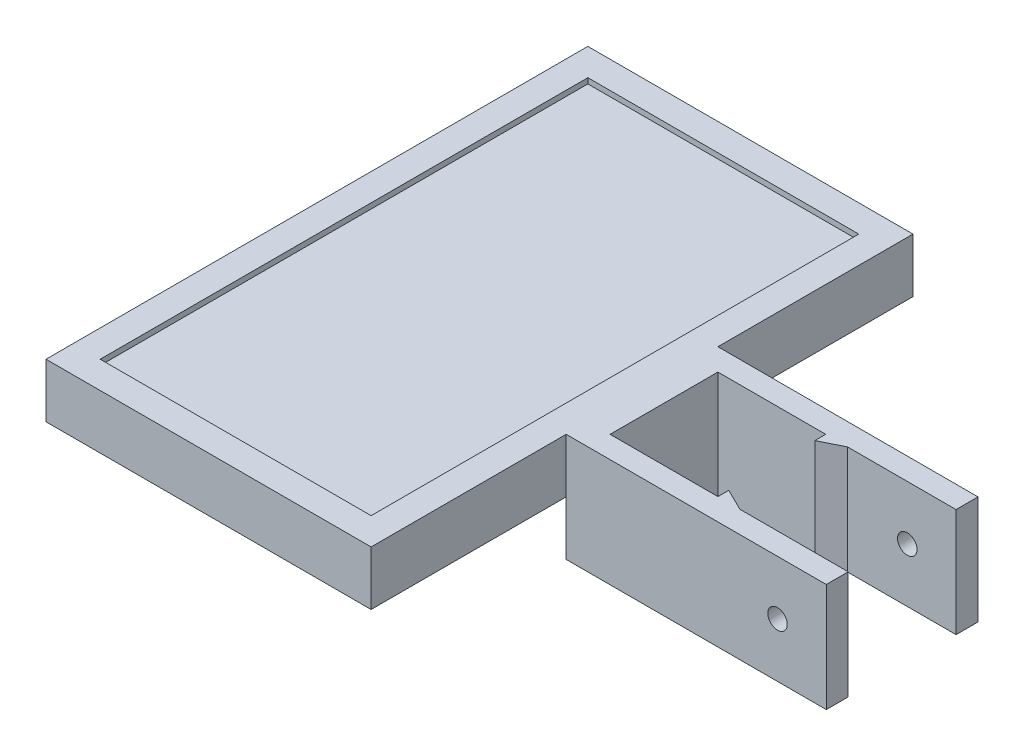
from build123d import *

# Parameters (mm, degrees)
SKETCH_1_W                      = 28
SKETCH_1_H                      = 28
SKETCH_1_W_2                    = 19.9
SKETCH_1_H_2                    = 19.9
EXTRUDE_1_DEPTH                 = 20
CUT_EXTRUDE_1_DEPTH             = 20
SKETCH_3_W                      = 20
SKETCH_3_H                      = 4.05
EXTRUDE_2_DEPTH                 = 20
CUT_EXTRUDE_2_REACH             = 48.148
SKETCH_4_R                      = 1.8
CUT_EXTRUDE_2_DIRECTION_2_REACH = 48.148
SKETCH_5_W                      = 60
SKETCH_5_H                      = 100
EXTRUDE_3_DEPTH                 = 10
SKETCH_6_W                      = 10
SKETCH_6_H                      = 10
EXTRUDE_4_DEPTH                 = 60
CUT_EXTRUDE_3_REACH             = 96.345
SKETCH_8_W                      = 50
SKETCH_8_H                      = 90
CUT_EXTRUDE_4_DEPTH             = 1


with BuildPart() as part:
    # 草图1 → 凸台-拉伸1 (new body)
    with BuildSketch(Plane(origin=(0, 0, 0), x_dir=(1, 0, 0), z_dir=(0, 1, 0))):
        Rectangle(SKETCH_1_W, SKETCH_1_H)
        Rectangle(SKETCH_1_W_2, SKETCH_1_H_2, mode=Mode.SUBTRACT)
    extrude(amount=EXTRUDE_1_DEPTH)

    # 草图2 → 切除-拉伸1 (cut)
    with BuildSketch(Plane(origin=(0, 20, 0), x_dir=(1, 0, 0), z_dir=(0, 1, 0))):
        Polygon((14, 9.95), (9.95, 7.95), (9.95, -7.95), (14, -9.95), align=None)
    extrude(amount=-CUT_EXTRUDE_1_DEPTH, mode=Mode.SUBTRACT)

    # 草图3 → 凸台-拉伸2 (add)
    with BuildSketch(Plane(origin=(0, 20, 0), x_dir=(1, 0, 0), z_dir=(0, 1, 0))):
        with Locations((24, 11.975)):
            Rectangle(SKETCH_3_W, SKETCH_3_H)
        with Locations((24, -11.975)):
            Rectangle(SKETCH_3_W, SKETCH_3_H)
    extrude(amount=-EXTRUDE_2_DEPTH)

    # 草图4 → 切除-拉伸2 (cut, up to next)
    with BuildSketch(Plane.XY.offset(-9.95), mode=Mode.PRIVATE) as cut_extrude_2_sk1:
        with Locations((25, 10)):
            Circle(SKETCH_4_R)
    cut_extrude_2_tool1 = extrude(cut_extrude_2_sk1.sketch, amount=-CUT_EXTRUDE_2_REACH, mode=Mode.PRIVATE) & part.part
    add(cut_extrude_2_tool1.solids().sort_by_distance((25, 10, -9.95))[0], mode=Mode.SUBTRACT)

    # 切除-拉伸2 direction 2: up to this face of the body (flat: up to its plane)
    cut_extrude_2_direction_2_end = Plane(part.part.faces().sort_by_distance((10, 10, 14))[0])
    # 草图4 → 切除-拉伸2 direction 2 (cut, up to the picked face)
    with BuildSketch(Plane.XY.offset(-9.95), mode=Mode.PRIVATE) as cut_extrude_2_direction_2_sk1:
        with Locations((25, 10)):
            Circle(SKETCH_4_R)
    cut_extrude_2_direction_2_tool1 = split(extrude(cut_extrude_2_direction_2_sk1.sketch, amount=CUT_EXTRUDE_2_DIRECTION_2_REACH, mode=Mode.PRIVATE), bisect_by=cut_extrude_2_direction_2_end, keep=Keep.BOTH, mode=Mode.PRIVATE)
    add(cut_extrude_2_direction_2_tool1.solids().sort_by(Axis((25, 10, -9.95), (0, 0, 1)))[0], mode=Mode.SUBTRACT)

    # 草图5 → 凸台-拉伸3 (add)
    with BuildSketch(Plane(origin=(0, 20, 0), x_dir=(1, 0, 0), z_dir=(0, 1, 0))):
        with Locations((-44, 0)):
            Rectangle(SKETCH_5_W, SKETCH_5_H)
    extrude(amount=-EXTRUDE_3_DEPTH)

    # 草图6 → 凸台-拉伸4 (add)
    with BuildSketch(Plane.ZY.offset(14)):
        with Locations((0, 5)):
            Rectangle(SKETCH_6_W, SKETCH_6_H)
    extrude(amount=EXTRUDE_4_DEPTH)

    # 草图7 → 切除-拉伸3 (cut, up to next)
    with BuildSketch(Plane.XY.offset(5), mode=Mode.PRIVATE) as cut_extrude_3_sk1:
        Polygon((-74, 10), (-74, 0), (-14, 0), align=None)
    cut_extrude_3_tool1 = extrude(cut_extrude_3_sk1.sketch, amount=-CUT_EXTRUDE_3_REACH, mode=Mode.PRIVATE) & part.part
    add(cut_extrude_3_tool1.solids().sort_by_distance((-54, 3.333333, 5))[0], mode=Mode.SUBTRACT)

    # 草图8 → 切除-拉伸4 (cut)
    with BuildSketch(Plane(origin=(0, 20, 0), x_dir=(1, 0, 0), z_dir=(0, 1, 0))):
        with Locations((-44, 0)):
            Rectangle(SKETCH_8_W, SKETCH_8_H)
    extrude(amount=-CUT_EXTRUDE_4_DEPTH, mode=Mode.SUBTRACT)


solid = part.part
